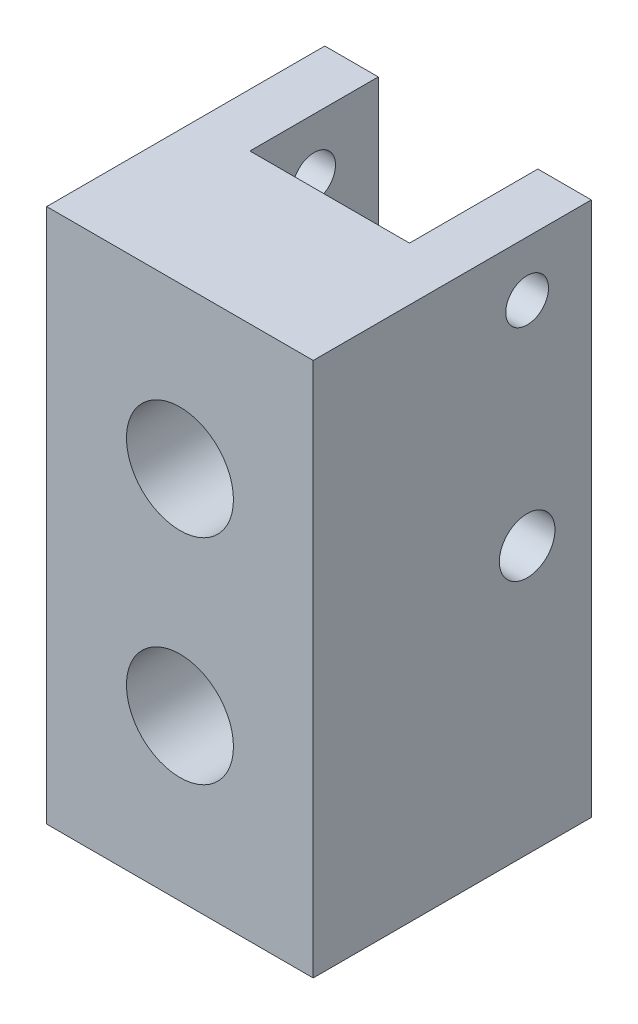
from build123d import *

# Parameters (mm, degrees)
BOSS_EXTRUDE1_DEPTH     = 63.5
SKETCH2_R               = 6.35
CUT_EXTRUDE1_DEPTH      = 79.25560529
CUT_EXTRUDE2_DEPTH      = 76.910329448
CUT_EXTRUDE2_DEPTH_BACK = 76.910329448
SKETCH5_R               = 3.302
SKETCH5_R_2             = 2.54


with BuildPart() as part:
    # Sketch1 → Boss-Extrude1 (new body)
    with BuildSketch(Plane(origin=(0, 0, 0), x_dir=(1, 0, 0), z_dir=(0, 1, 0))):
        Polygon((0, 0), (0, 33.02), (6.35, 33.02), (6.35, 17.78), (25.294420667, 17.78), (25.294420667, 33.02), (31.644420667, 33.02), (31.644420667, 0), align=None)
    extrude(amount=BOSS_EXTRUDE1_DEPTH)

    # Sketch2 → Cut-Extrude1 (cut, through all)
    with BuildSketch(Plane.XY):
        with Locations((15.822210333, 44.45)):
            Circle(SKETCH2_R)
        with Locations((15.822210333, 19.05)):
            Circle(SKETCH2_R)
    extrude(amount=-CUT_EXTRUDE1_DEPTH, mode=Mode.SUBTRACT)

    # Sketch5 → Cut-Extrude2 (cut, two sides: drawn at the far end of the back side and taken through both)
    with BuildSketch(Plane(origin=(6.35, 0, 0), x_dir=(0, 0, -1), z_dir=(1, 0, 0)).offset(-CUT_EXTRUDE2_DEPTH_BACK)):
        with Locations((25.4, 31.75)):
            Circle(SKETCH5_R)
        with Locations((25.4, 56.989992478)):
            Circle(SKETCH5_R_2)
    extrude(amount=CUT_EXTRUDE2_DEPTH + CUT_EXTRUDE2_DEPTH_BACK, mode=Mode.SUBTRACT)


solid = part.part
